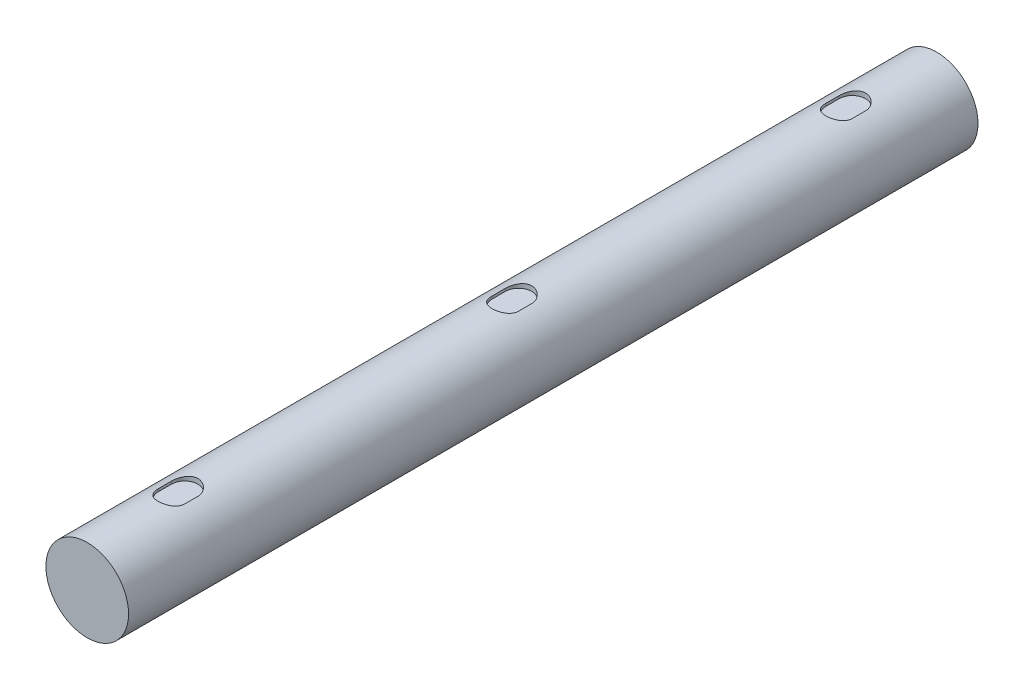
from build123d import *

# Parameters (mm, degrees)
SKETCH_1_R          = 12.5
EXTRUDE_1_DEPTH     = 257
CUT_EXTRUDE_1_DEPTH = 0.975


with BuildPart() as part:
    # 草图1 → 凸台-拉伸1 (new body)
    with BuildSketch(Plane.XY):
        Circle(SKETCH_1_R)
    extrude(amount=EXTRUDE_1_DEPTH)

    # 草图6 → 切除-拉伸1 (cut, symmetric)
    with BuildSketch(Plane(origin=(0, 12, 0), x_dir=(1, 0, 0), z_dir=(0, 1, 0))):
        with BuildLine():
            Line((-4, -29.5), (-4, -25.5))
            ThreePointArc((-4, -25.5), (0, -21.5), (4, -25.5))
            Line((4, -25.5), (4, -29.5))
            ThreePointArc((4, -29.5), (0, -33.5), (-4, -29.5))
        make_face()
        with BuildLine():
            Line((-4, -126.5), (-4, -130.5))
            ThreePointArc((-4, -130.5), (0, -134.5), (4, -130.5))
            Line((4, -130.5), (4, -126.5))
            ThreePointArc((4, -126.5), (0, -122.5), (-4, -126.5))
        make_face()
    cut_extrude_1 = extrude(amount=CUT_EXTRUDE_1_DEPTH, both=True, mode=Mode.SUBTRACT)

    # 镜向1: 切除-拉伸1 across plane
    add(cut_extrude_1.mirror(Plane(origin=(0, 0, 128.5), x_dir=(1, 0, 0), z_dir=(0, 0, -1))), mode=Mode.SUBTRACT)


solid = part.part
